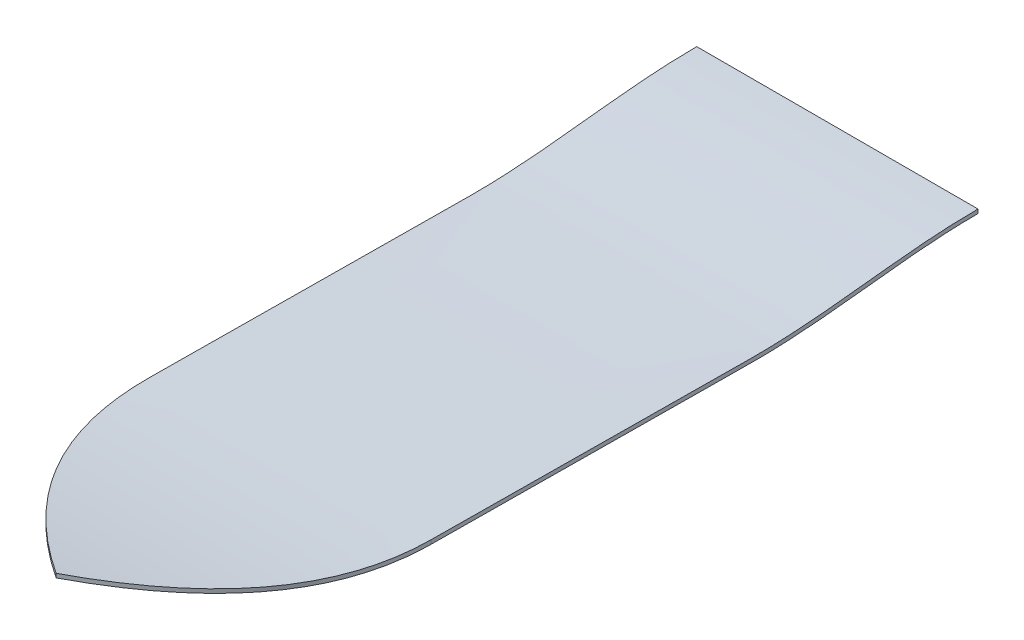
from build123d import *

# Parameters (mm, degrees)
BOSS_EXTRUDE1_DEPTH      = 1524
BOSS_EXTRUDE1_DEPTH_BACK = 1524
CUT_EXTRUDE1_DEPTH       = 2971.334706017
CUT_EXTRUDE1_DEPTH_BACK  = 2971.334706017
SKETCH3_W                = 5731.45735109
SKETCH3_H                = 7343.9774621


with BuildPart() as part:
    # Sketch1 → Boss-Extrude1 (new, two sides: drawn at the far end of the back side and taken through both)
    with BuildSketch(Plane(origin=(0, 0, 0), x_dir=(0, 0, -1), z_dir=(1, 0, 0)).offset(-BOSS_EXTRUDE1_DEPTH_BACK)):
        with BuildLine():
            Line((-2543.983620891, 91.500570068), (-2547.928552887, 66.408788315))
            add(Edge.make_bspline(
                [(-2547.928552887, 66.408788315), (-2542.105684338, 65.493316442), (-2530.46631391, 63.676489066), (-2507.112577211, 60.083503089), (-2477.826048238, 55.675793735), (-2442.516726356, 50.517885926), (-2395.222130959, 43.816594485), (-2335.697444714, 35.769425786), (-2263.618234042, 26.639961703), (-2190.889209569, 18.037515907), (-2093.050791937, 7.270175081), (-1969.128182432, -4.871860435), (-1817.821496687, -17.335536668), (-1663.914846889, -27.692955364), (-1507.408429898, -35.944994341), (-1374.818232478, -41.066683579), (-1267.448528406, -44.113566075), (-1186.263962878, -45.868068288), (-1118.091308787, -46.906724557), (-1063.174332439, -47.440708029), (-1008.358706053, -47.932840303), (-939.802208331, -48.565603467), (-830.132156253, -49.567925143), (-693.037131286, -50.823892641), (-528.525832615, -52.329314041), (-364.013775929, -53.835150797), (-199.501939719, -55.340892605), (-34.990042365, -56.846659346), (129.521840685, -58.352416097), (294.033723774, -59.858171071), (458.545614851, -61.363938356), (595.63886235, -62.618744472), (705.313664164, -63.62295068), (787.570168186, -64.37625734), (856.116870754, -65.003920803), (910.954206669, -65.504801547), (945.226222852, -65.819040387), (969.218546989, -66.035780436), (982.921278871, -66.165679202), (996.724364691, -66.274488824), (1013.862181684, -66.336294882), (1041.169862836, -66.300266795), (1075.035296353, -65.998438619), (1128.694009016, -65.000777719), (1194.815870346, -62.841500309), (1272.789633687, -58.966755677), (1349.536899656, -53.983476183), (1450.427706366, -46.094404041), (1574.211953424, -34.336590519), (1720.214259372, -18.588585689), (1864.875844249, -2.590206527), (1985.316604958, 9.801057862), (2082.212504816, 18.464705862), (2155.309626953, 24.167335273), (2228.986179203, 28.904666927), (2290.994880468, 31.906447902), (2341.047381855, 33.655381718), (2378.827009026, 34.619613478), (2410.533440068, 35.115891624), (2436.026851529, 35.317945116), (2448.844419205, 35.352211204), (2455.244379109, 35.352211204)],
                knots=[0, 0, 0, 0, 0.00390625, 0.0078125, 0.015625, 0.0234375, 0.03125, 0.046875, 0.0625, 0.078125, 0.09375, 0.125, 0.15625, 0.1875, 0.21875, 0.25, 0.265625, 0.28125, 0.296875, 0.3046875, 0.3125, 0.328125, 0.34375, 0.375, 0.40625, 0.4375, 0.46875, 0.5, 0.53125, 0.5625, 0.59375, 0.625, 0.640625, 0.65625, 0.671875, 0.6796875, 0.6875, 0.69140625, 0.693359375, 0.6953125, 0.69921875, 0.703125, 0.7109375, 0.71875, 0.734375, 0.75, 0.765625, 0.78125, 0.8125, 0.84375, 0.875, 0.90625, 0.921875, 0.9375, 0.953125, 0.96875, 0.9765625, 0.984375, 0.9921875, 0.99609375, 1, 1, 1, 1], degree=3))
            Line((2455.244379109, 35.352211204), (2455.244379109, 60.752211204))
            add(Edge.make_bspline(
                [(-2543.983620891, 91.500570068), (-2312.035580769, 55.033680082), (-1972.073883028, 16.227654851), (-1494.655069529, -12.393640456), (-1247.390010346, -19.826032299), (-1100.639201875, -21.676942451), (-1073.239826601, -21.943396342), (-1052.673202444, -22.129495205), (-953.281518673, -23.039959986), (-775.061118852, -24.671851119), (-500.874569462, -27.181392544), (-199.269457953, -29.941962734), (129.754315637, -32.953481324), (431.359432405, -35.71403098), (705.545955512, -38.223675062), (878.627736523, -39.809427698), (972.876611233, -40.6693717), (986.587550391, -40.796468465), (1005.396014769, -40.9270339), (1088.693400392, -41.02208833), (1233.800754896, -36.72664045), (1715.239092527, -3.018390136), (2093.620176364, 60.752211204), (2455.244379109, 60.752211204)],
                knots=[0, 0, 0, 0, 0.15625, 0.21875, 0.2890625, 0.30078125, 0.302734375, 0.3046875, 0.3125, 0.359375, 0.40625, 0.46875, 0.53125, 0.59375, 0.640625, 0.6875, 0.692382812, 0.694335938, 0.6953125, 0.703125, 0.7421875, 0.78125, 1, 1, 1, 1], degree=3))
        make_face()
    extrude(amount=BOSS_EXTRUDE1_DEPTH + BOSS_EXTRUDE1_DEPTH_BACK)

    # Sketch3 → Cut-Extrude1 (cut, two sides: drawn at the far end of the back side and taken through both)
    with BuildSketch(Plane(origin=(0, 0, 0), x_dir=(1, 0, 0), z_dir=(0, 1, 0)).offset(-CUT_EXTRUDE1_DEPTH_BACK)):
        with Locations((889.204947701, -870.266531084)):
            Rectangle(SKETCH3_W, SKETCH3_H)
        with BuildLine():
            Line((-899.996230165, -1044.755620891), (-899.996230165, 2455.244379109))
            Line((-899.996230165, 2455.244379109), (900.003769835, 2455.244379109))
            Line((900.003769835, 2455.244379109), (900.003769835, -1044.755620891))
            add(Edge.make_bspline(
                [(900.003769835, -1044.755620891), (900.003769835, -1919.394226074), (0.003769835, -2544.755620891)],
                knots=[0, 0, 0, 1, 1, 1], degree=2))
            add(Edge.make_bspline(
                [(-899.996230165, -1044.755620891), (-899.996230165, -1919.394226074), (0.003769835, -2544.755620891)],
                knots=[0, 0, 0, 1, 1, 1], degree=2))
        make_face(mode=Mode.SUBTRACT)
    extrude(amount=CUT_EXTRUDE1_DEPTH + CUT_EXTRUDE1_DEPTH_BACK, mode=Mode.SUBTRACT)


solid = part.part
